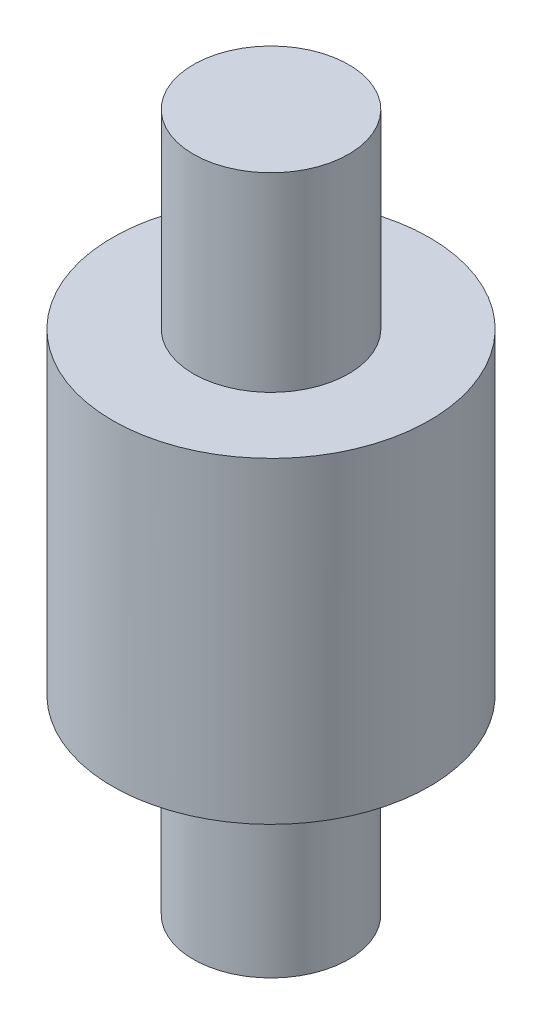
from build123d import *

# Parameters (mm, degrees)
SKETCH2_R           = 5
BOSS_EXTRUDE1_DEPTH = 22
CUT_EXTRUDE1_START  = -6
SKETCH3_R           = 5
SKETCH3_R_2         = 2.45
CUT_EXTRUDE1_DEPTH  = 6
SKETCH4_R           = 5
SKETCH4_R_2         = 2.45
CUT_EXTRUDE2_DEPTH  = 6


with BuildPart() as part:
    # Sketch2 → Boss-Extrude1 (new body)
    with BuildSketch(Plane(origin=(0, 0, 0), x_dir=(1, 0, 0), z_dir=(0, 1, 0))):
        with Locations(Location((0, 0, 0), (0, 0, 270))):
            Circle(SKETCH2_R)
    extrude(amount=BOSS_EXTRUDE1_DEPTH)

    # Sketch3 → Cut-Extrude1 (cut)
    with BuildSketch(Plane(origin=(0, 22, 0), x_dir=(1, 0, 0), z_dir=(0, 1, 0)).offset(CUT_EXTRUDE1_START)):
        with Locations(Location((0, 0, 0), (0, 0, 270))):
            Circle(SKETCH3_R)
        with Locations(Location((0, 0, 0), (0, 0, 270))):
            Circle(SKETCH3_R_2, mode=Mode.SUBTRACT)
    extrude(amount=CUT_EXTRUDE1_DEPTH, mode=Mode.SUBTRACT)

    # Sketch4 → Cut-Extrude2 (cut)
    with BuildSketch(Plane.XZ):
        with Locations(Location((0, 0, 0), (0, 0, 270))):
            Circle(SKETCH4_R)
        with Locations(Location((0, 0, 0), (0, 0, 90))):
            Circle(SKETCH4_R_2, mode=Mode.SUBTRACT)
    extrude(amount=-CUT_EXTRUDE2_DEPTH, mode=Mode.SUBTRACT)


solid = part.part
